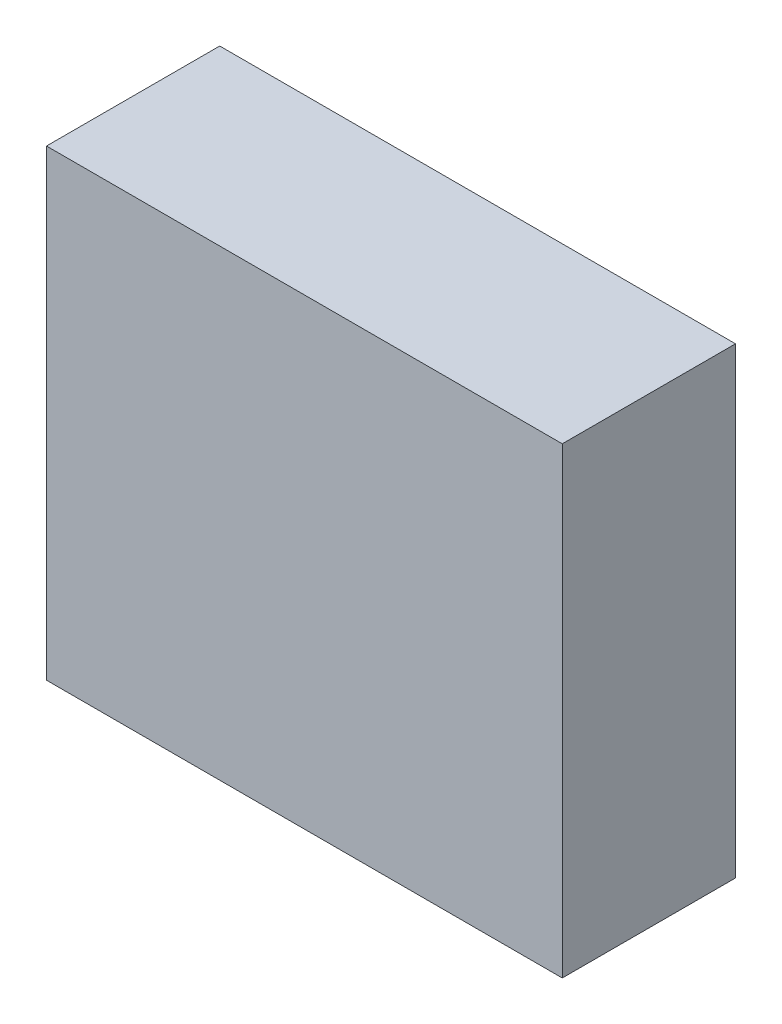
from build123d import *

# Parameters (mm, degrees)
SKETCH1_W               = 2.9776
SKETCH1_H               = 2.6708
COMPONENT_OUTLINE_DEPTH = 1


with BuildPart() as part:
    # Sketch1 → Component_Outline (new body)
    with BuildSketch(Plane.XY):
        with Locations((0, 0.1534)):
            Rectangle(SKETCH1_W, SKETCH1_H)
    extrude(amount=COMPONENT_OUTLINE_DEPTH)


solid = part.part
